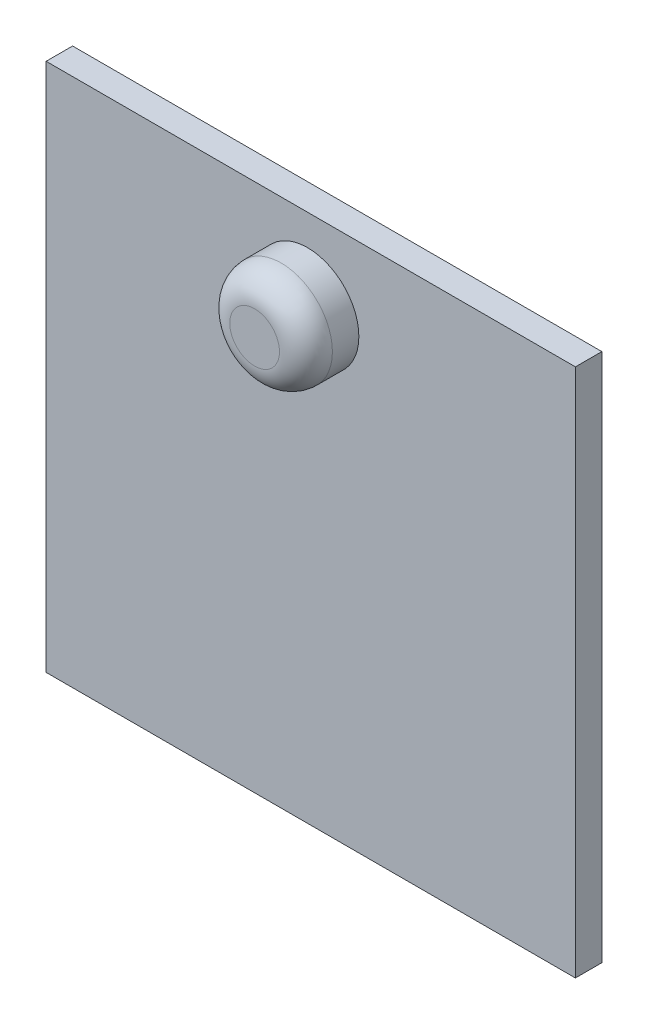
from build123d import *

# Parameters (mm, degrees)
SKETCH1_W           = 200
SKETCH1_H           = 200
BOSS_EXTRUDE1_DEPTH = 10
SKETCH2_R           = 19.385831102
BOSS_EXTRUDE2_DEPTH = 20
FILLET1_R           = 10


with BuildPart() as part:
    # Sketch1 → Boss-Extrude1 (new body)
    with BuildSketch(Plane.XY):
        with Locations((44.53125, 36.71875)):
            Rectangle(SKETCH1_W, SKETCH1_H)
    extrude(amount=BOSS_EXTRUDE1_DEPTH)

    # Sketch2 → Boss-Extrude2 (add)
    with BuildSketch(Plane.XY.offset(10)):
        with Locations((43.320392106, 105.737649961)):
            Circle(SKETCH2_R)
    extrude(amount=BOSS_EXTRUDE2_DEPTH)

    # Fillet1
    fillet1_edges = [part.edges().sort_by_distance(p)[0] for p in [
        (23.934561004, 105.737649961, 30),
    ]]
    fillet(fillet1_edges, radius=FILLET1_R)


solid = part.part
